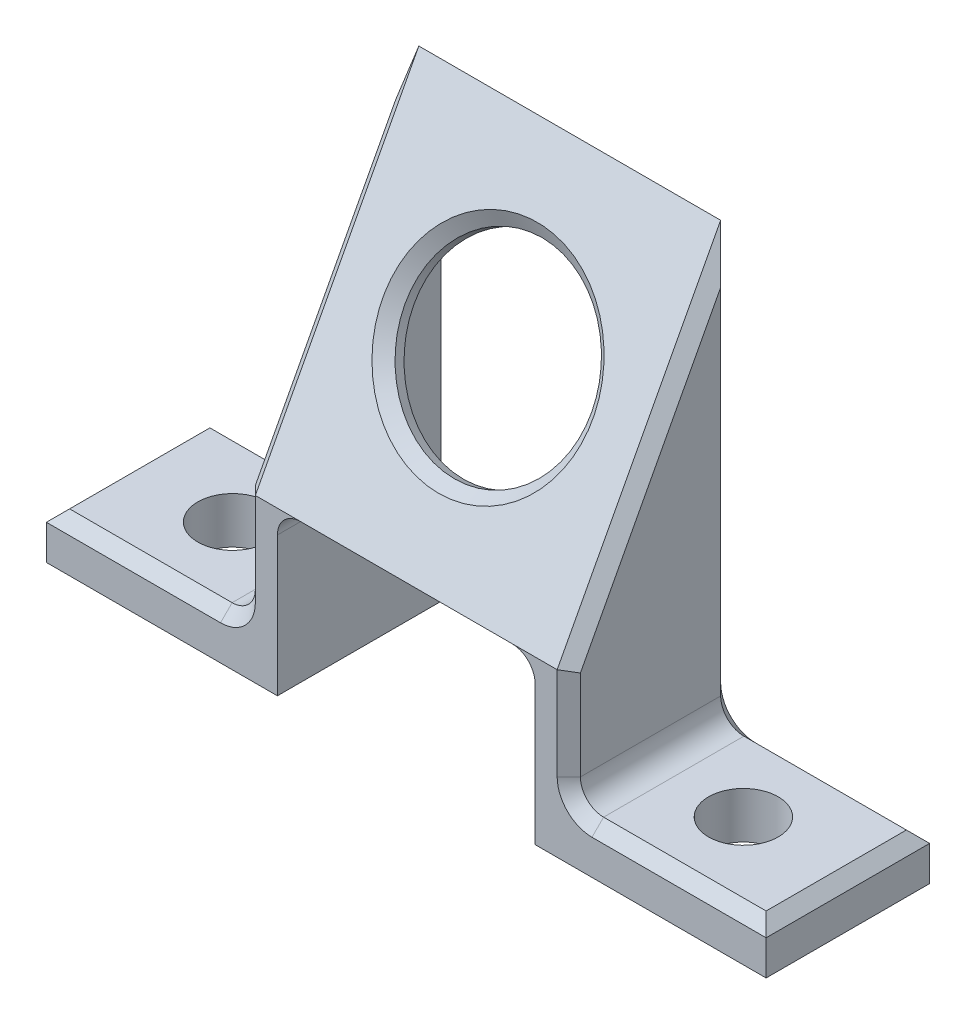
from build123d import *

# Parameters (mm, degrees)
BOSS_EXTRUDE1_DEPTH      = 14
BOSS_EXTRUDE1_DEPTH_BACK = 14
BOSS_EXTRUDE3_DEPTH      = 14.084146884
CUT_EXTRUDE1_START       = 11.1
CUT_EXTRUDE1_DEPTH       = 22.2
SKETCH7_R                = 8.05
CUT_EXTRUDE2_DEPTH       = 3
SKETCH8_R                = 3
CUT_EXTRUDE4_DEPTH       = 50.90760018
FILLET4_R                = 2
CHAMFER6_SIZE            = 1


with BuildPart() as part:
    # Sketch1 → Boss-Extrude1 (new, two sides: drawn at the far end of the back side and taken through both)
    with BuildSketch(Plane(origin=(0, 0, 0), x_dir=(0, 0, -1), z_dir=(1, 0, 0)).offset(-BOSS_EXTRUDE1_DEPTH_BACK)):
        Polygon((0, 0), (14.084146884, 0), (14.084146884, 26.488427786), align=None)
    extrude(amount=BOSS_EXTRUDE1_DEPTH + BOSS_EXTRUDE1_DEPTH_BACK)

    # Sketch5 → Boss-Extrude3 (add)
    with BuildSketch(Plane.XY):
        Polygon((14, -10), (14, 0), (11.1, 0), (11.1, -14), (31, -14), (31, -10), align=None)
        Polygon((-14, 0), (-14, -10), (-31, -10), (-31, -14), (-11.1, -14), (-11.1, 0), align=None)
    extrude(amount=-BOSS_EXTRUDE3_DEPTH)

    # Sketch6 → Cut-Extrude1 (cut)
    with BuildSketch(Plane(origin=(0, 0, 0), x_dir=(0, 0, -1), z_dir=(1, 0, 0)).offset(CUT_EXTRUDE1_START)):
        Polygon((14.084146884, 0), (2.126837727, 0), (14.084146884, 22.488427786), align=None)
    extrude(amount=-CUT_EXTRUDE1_DEPTH, mode=Mode.SUBTRACT)

    # Sketch7 → Cut-Extrude2 (cut)
    with BuildSketch(Plane(origin=(0, 0, 0), x_dir=(1, 0, 0), z_dir=(0, 0.4694715627858856, 0.8829475928589298))):
        with Locations(Location((0, 15, 0), (0, 0, 270))):
            Circle(SKETCH7_R)
    extrude(amount=-CUT_EXTRUDE2_DEPTH, mode=Mode.SUBTRACT)

    # Sketch8 → Cut-Extrude4 (cut, through all)
    with BuildSketch(Plane(origin=(0, -10, 0), x_dir=(1, 0, 0), z_dir=(0, 1, 0))):
        with Locations(Location((22, 7.042073442, 0), (0, 0, 270))):
            Circle(SKETCH8_R)
        with Locations(Location((-22, 7.042073442, 0), (0, 0, 90))):
            Circle(SKETCH8_R)
    extrude(amount=-CUT_EXTRUDE4_DEPTH, mode=Mode.SUBTRACT)

    # Fillet4
    fillet4_edges = [part.edges().sort_by_distance(p)[0] for p in [
        (14, -10, -7.042073442),
        (-14, -10, -7.042073442),
        (-11.1, 0, -1.063418863),
        (11.1, 0, -1.063418863),
        (11.1, 11.244213893, -8.105492305),
        (-11.1, 11.244213893, -8.105492305),
    ]]
    fillet(fillet4_edges, radius=FILLET4_R)

    # Chamfer6
    chamfer6_edges = [part.edges().sort_by_distance(p)[0] for p in [
        (14, 13.244213893, -7.042073442),
        (14.585786438, -9.414213562, 0),
        (14.585786438, -9.414213562, -14.084146884),
        (-14.585786438, -9.414213562, 0),
        (-14.585786438, -9.414213562, -14.084146884),
        (31, -10, -7.042073442),
        (14, -4, 0),
        (-31, -10, -7.042073442),
        (-14, -4, 0),
        (-14, 13.244213893, -7.042073442),
        (0, 20.351942015, -10.821319522),
        (23.5, -10, -14.084146884),
        (23.5, -10, 0),
        (14, 13.244213893, -14.084146884),
        (-14, 13.244213893, -14.084146884),
        (-23.5, -10, -14.084146884),
        (-23.5, -10, 0),
    ]]
    chamfer(chamfer6_edges, length=CHAMFER6_SIZE)


solid = part.part
